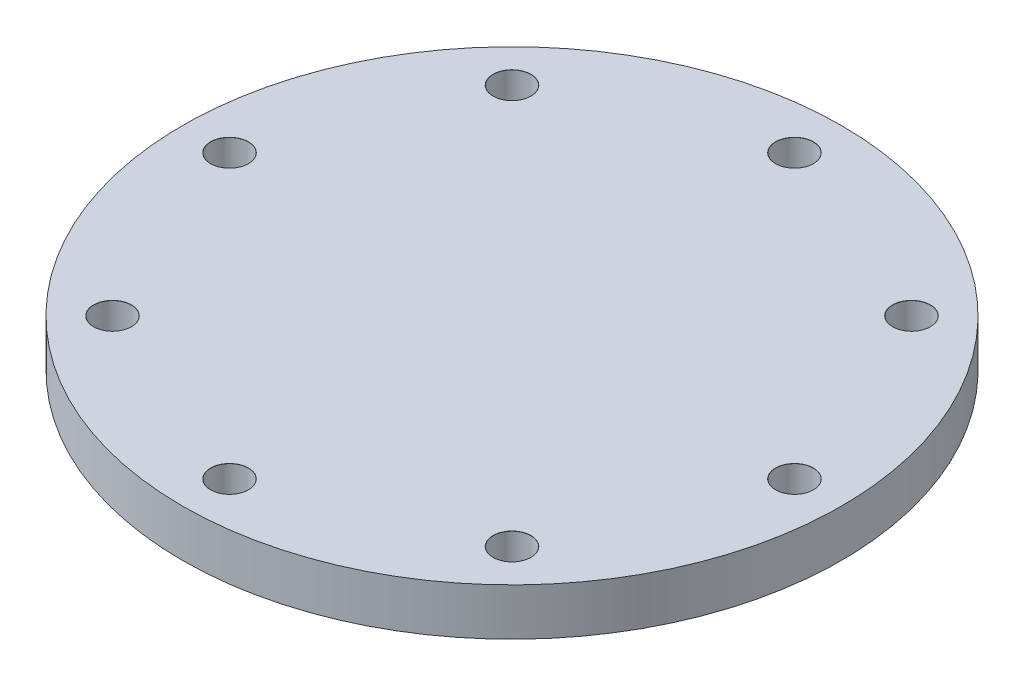
from build123d import *

# Parameters (mm, degrees)
SKETCH_1_W                   = 70
SKETCH_1_H                   = 10
HOLE_WIZARD_M8_1_D           = 8
HOLE_WIZARD_M8_1_CSINK_D     = 8.05
HOLE_WIZARD_M8_1_CSINK_ANGLE = 100
PATTERN_CIRCULAR_2_COUNT     = 8


with BuildPart() as part:
    # 草图1 → 旋转1 (revolve)
    with BuildSketch(Plane.XY):
        with Locations((-35, 5)):
            Rectangle(SKETCH_1_W, SKETCH_1_H)
    revolve(axis=Axis((0, 76.619497233, 0), (0, -1, 0)))

    # M8 螺纹孔1 (through all)
    with Locations(Plane(origin=(0, 10, 0), x_dir=(1, 0, 0), z_dir=(0, 1, 0))):
        with Locations((-60, 0)):
            hole_wizard_m8_1 = CounterSinkHole(HOLE_WIZARD_M8_1_D / 2, HOLE_WIZARD_M8_1_CSINK_D / 2, counter_sink_angle=HOLE_WIZARD_M8_1_CSINK_ANGLE)

    # 阵列(圆周)2: M8 螺纹孔1 ×8 about axis
    pattern_circular_2_axis = Axis((0, 76.619497233, 0), (0, -1, 0))
    for i in range(1, PATTERN_CIRCULAR_2_COUNT):
        add(hole_wizard_m8_1.rotate(pattern_circular_2_axis, i * 360 / PATTERN_CIRCULAR_2_COUNT), mode=Mode.SUBTRACT)


solid = part.part
